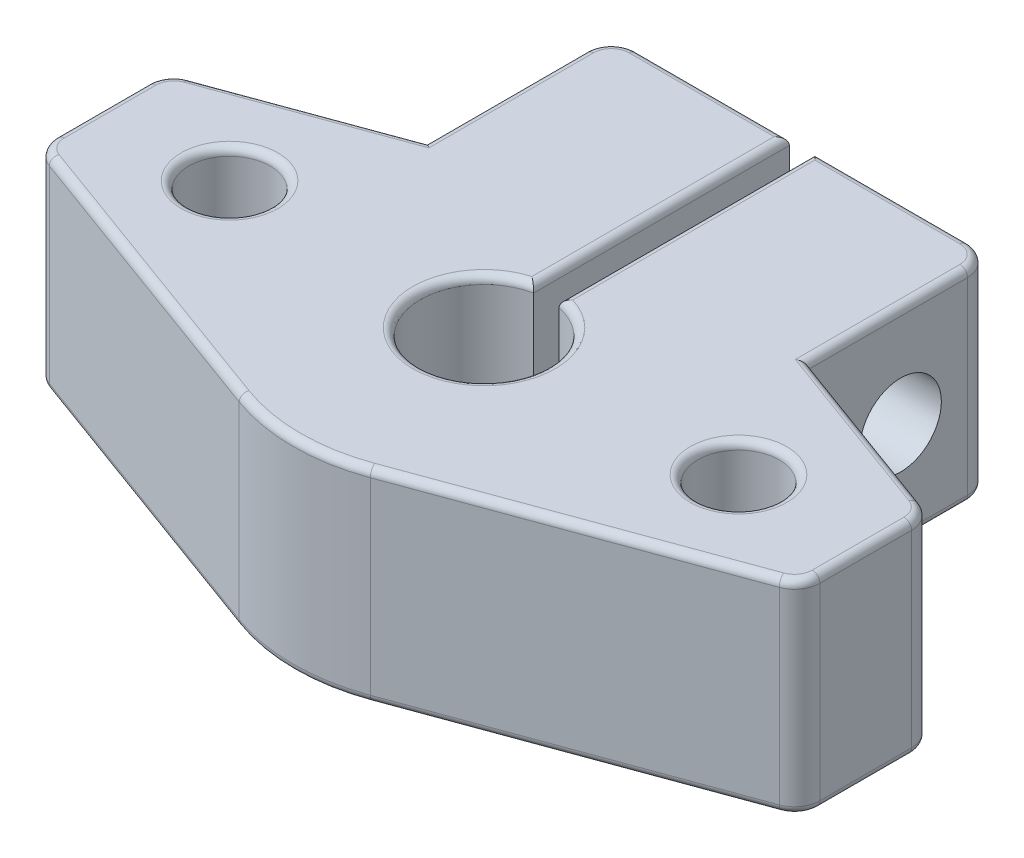
from build123d import *

# Parameters (mm, degrees)
CROQUIS_1_R             = 1.6
SALIENTE_EXTRUIR1_DEPTH = 8
REDONDEO1_R             = 1
REDONDEO2_R             = 1
CROQUIS_2_R             = 1.6
CORTE_EXTRUIR1_DEPTH    = 27.953663944
REDONDEO3_R             = 1
REDONDEO4_R             = 0.3


with BuildPart() as part:
    # Croquis 1 → Saliente-Extruir1 (new body)
    with BuildSketch(Plane(origin=(0, 0, 0), x_dir=(1, 0, 0), z_dir=(0, 1, 0))):
        with BuildLine():
            Line((-15, 2.5), (-15, -2.5))
            Line((-15, -2.5), (-2.576046766, -7.043719405))
            ThreePointArc((-2.576046766, -7.043719405), (0, -7.5), (2.576046766, -7.043719405))
            Line((2.576046766, -7.043719405), (15, -2.5))
            Line((15, -2.5), (15, 2.5))
            Line((15, 2.5), (7.5, 5.242918852))
            Line((7.5, 5.242918852), (7.5, 12.5))
            Line((7.5, 12.5), (0.5, 12.5))
            Line((0.5, 12.5), (0.5, 9.987492178))
            Line((0.5, 9.987492178), (0.5, 2.449489743))
            ThreePointArc((0.5, 2.449489743), (0, -2.5), (-0.5, 2.449489743))
            Line((-0.5, 2.449489743), (-0.5, 9.987492178))
            Line((-0.5, 9.987492178), (-0.5, 12.5))
            Line((-0.5, 12.5), (-7.5, 12.5))
            Line((-7.5, 12.5), (-7.5, 5.242918852))
            Line((-7.5, 5.242918852), (-15, 2.5))
        make_face()
        with Locations(Location((-10, 0, 0), (0, 0, 270))):
            Circle(CROQUIS_1_R, mode=Mode.SUBTRACT)
        with Locations(Location((10, 0, 0), (0, 0, 270))):
            Circle(CROQUIS_1_R, mode=Mode.SUBTRACT)
    extrude(amount=SALIENTE_EXTRUIR1_DEPTH)

    # Redondeo1
    redondeo1_edges = [part.edges().sort_by_distance(p)[0] for p in [
        (15, 4, 2.5),
    ]]
    fillet(redondeo1_edges, radius=REDONDEO1_R)

    # Redondeo2
    redondeo2_edges = [part.edges().sort_by_distance(p)[0] for p in [
        (15, 4, -2.5),
        (-15, 4, 2.5),
        (-15, 4, -2.5),
    ]]
    fillet(redondeo2_edges, radius=REDONDEO2_R)

    # Croquis 2 → Corte-Extruir1 (cut, through all)
    with BuildSketch(Plane(origin=(7.5, 0, 0), x_dir=(0, 0, -1), z_dir=(1, 0, 0))):
        with Locations((8.871459426, 4)):
            Circle(CROQUIS_2_R)
    extrude(amount=-CORTE_EXTRUIR1_DEPTH, mode=Mode.SUBTRACT)

    # Redondeo3
    redondeo3_edges = [part.edges().sort_by_distance(p)[0] for p in [
        (7.5, 4, -12.5),
        (-7.5, 4, -12.5),
    ]]
    fillet(redondeo3_edges, radius=REDONDEO3_R)

    # Redondeo4
    redondeo4_edges = [part.edges().sort_by_distance(p)[0] for p in [
        (-3.5, 8, -12.5),
        (0.5, 0, -7.474744871),
        (7.5, 0, -8.371459426),
        (8.459759834, 0, 4.891913073),
        (0, 0, 7.5),
        (-10.921736451, 0, -3.991512796),
        (-3.5, 0, -12.5),
        (-10.921736451, 8, -3.991512796),
        (-0.5, 0, -7.474744871),
        (0, 0, 2.5),
        (0, 8, 7.5),
        (8.459759834, 8, 4.891913073),
        (-10, 0, -1.6),
        (-10, 8, -1.6),
        (0, 8, 2.5),
        (7.5, 8, -8.371459426),
        (10, 0, -1.6),
        (10, 8, -1.6),
        (0.5, 8, -7.474744871),
        (15, 0, 0),
        (15, 8, 0),
        (14.819595297, 0, 2.373887038),
        (14.819595297, 8, 2.373887038),
        (-15, 0, 0),
        (-15, 8, 0),
        (-8.459759834, 0, 4.891913073),
        (10.921736451, 0, -3.991512796),
        (14.819595297, 0, -2.373887038),
        (-14.819595297, 0, 2.373887038),
        (-14.819595297, 0, -2.373887038),
        (10.921736451, 8, -3.991512796),
        (-8.459759834, 8, 4.891913073),
        (14.819595297, 8, -2.373887038),
        (-14.819595297, 8, 2.373887038),
        (-14.819595297, 8, -2.373887038),
        (-0.5, 8, -7.474744871),
        (3.5, 0, -12.5),
        (3.5, 8, -12.5),
        (-7.5, 0, -8.371459426),
        (-7.207106781, 0, -12.207106781),
        (7.207106781, 0, -12.207106781),
        (-7.5, 8, -8.371459426),
        (-7.207106781, 8, -12.207106781),
        (7.207106781, 8, -12.207106781),
    ]]
    fillet(redondeo4_edges, radius=REDONDEO4_R)


solid = part.part
